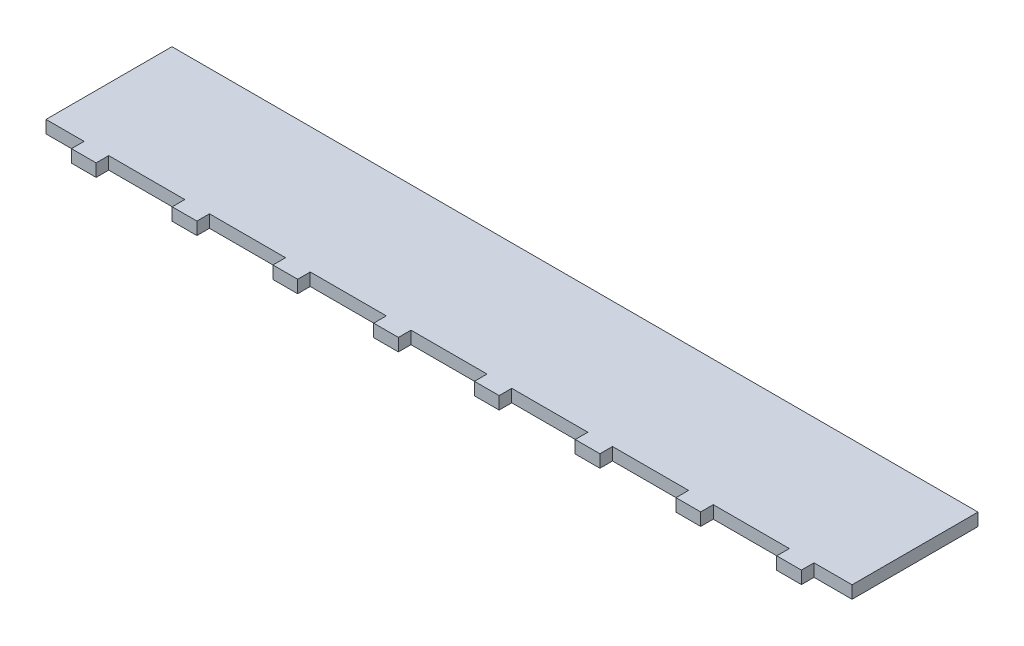
from build123d import *

# Parameters (mm, degrees)
SKETCH1_W           = 203.2
SKETCH1_H           = 31.75
BOSS_EXTRUDE1_DEPTH = 3.175
SKETCH2_W           = 6.223
SKETCH2_H           = 3.175
BOSS_EXTRUDE2_DEPTH = 3.175
LPATTERN1_COUNT     = 8
LPATTERN1_PITCH     = 25.4


with BuildPart() as part:
    # Sketch1 → Boss-Extrude1 (new body)
    with BuildSketch(Plane(origin=(0, 0, 0), x_dir=(1, 0, 0), z_dir=(0, 1, 0))):
        Rectangle(SKETCH1_W, SKETCH1_H)
    extrude(amount=BOSS_EXTRUDE1_DEPTH)

    # Sketch2 → Boss-Extrude2 (add)
    with BuildSketch(Plane.XY.offset(15.875)):
        with Locations((88.9, 1.5875)):
            Rectangle(SKETCH2_W, SKETCH2_H)
    boss_extrude2 = extrude(amount=BOSS_EXTRUDE2_DEPTH)

    # LPattern1: Boss-Extrude2 ×8
    with Locations(*[(-i * LPATTERN1_PITCH, 0, 0) for i in range(1, LPATTERN1_COUNT)]):
        add(boss_extrude2)


solid = part.part
